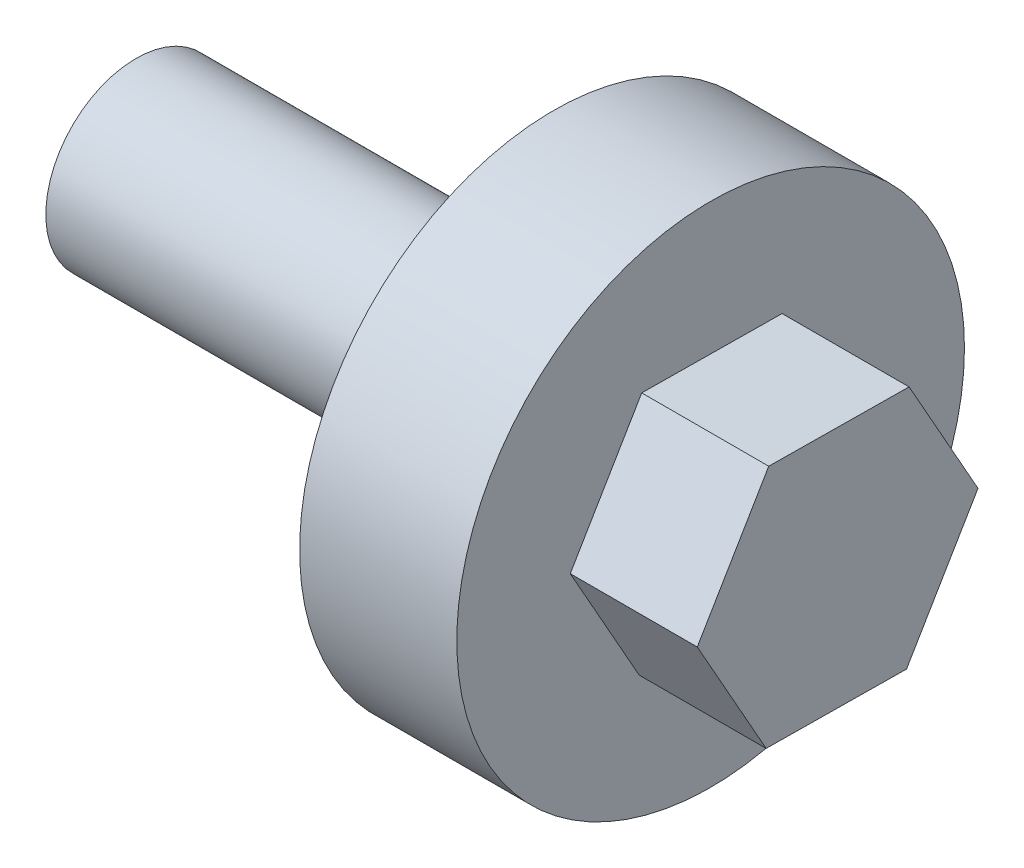
from build123d import *

# Parameters (mm, degrees)
SKETCH1_R           = 46.334426
BOSS_EXTRUDE1_DEPTH = 28.68422
BOSS_EXTRUDE2_DEPTH = 23.18258
SKETCH3_R           = 16.460544738
BOSS_EXTRUDE3_DEPTH = 76.2


with BuildPart() as part:
    # Sketch1 → Boss-Extrude1 (new body)
    with BuildSketch(Plane(origin=(0, 0, 0), x_dir=(0, 0, -1), z_dir=(1, 0, 0))):
        with Locations((-75.529694, 661.049224)):
            Circle(SKETCH1_R)
    extrude(amount=BOSS_EXTRUDE1_DEPTH)

    # Sketch2 → Boss-Extrude2 (add)
    with BuildSketch(Plane(origin=(28.68422, 0, 0), x_dir=(0, 0, -1), z_dir=(1, 0, 0))):
        Polygon((-101.15042, 661.318972), (-88.573665621, 638.995898421), (-62.952939621, 638.726150421), (-49.908968, 660.779476), (-62.485722379, 683.102549579), (-88.106448379, 683.372297579), align=None)
    extrude(amount=BOSS_EXTRUDE2_DEPTH)

    # Sketch3 → Boss-Extrude3 (add)
    with BuildSketch(Plane.ZY):
        with Locations(Location((75.529694, 661.049224, 0), (0, 0, 180))):
            Circle(SKETCH3_R)
    extrude(amount=BOSS_EXTRUDE3_DEPTH)


solid = part.part
